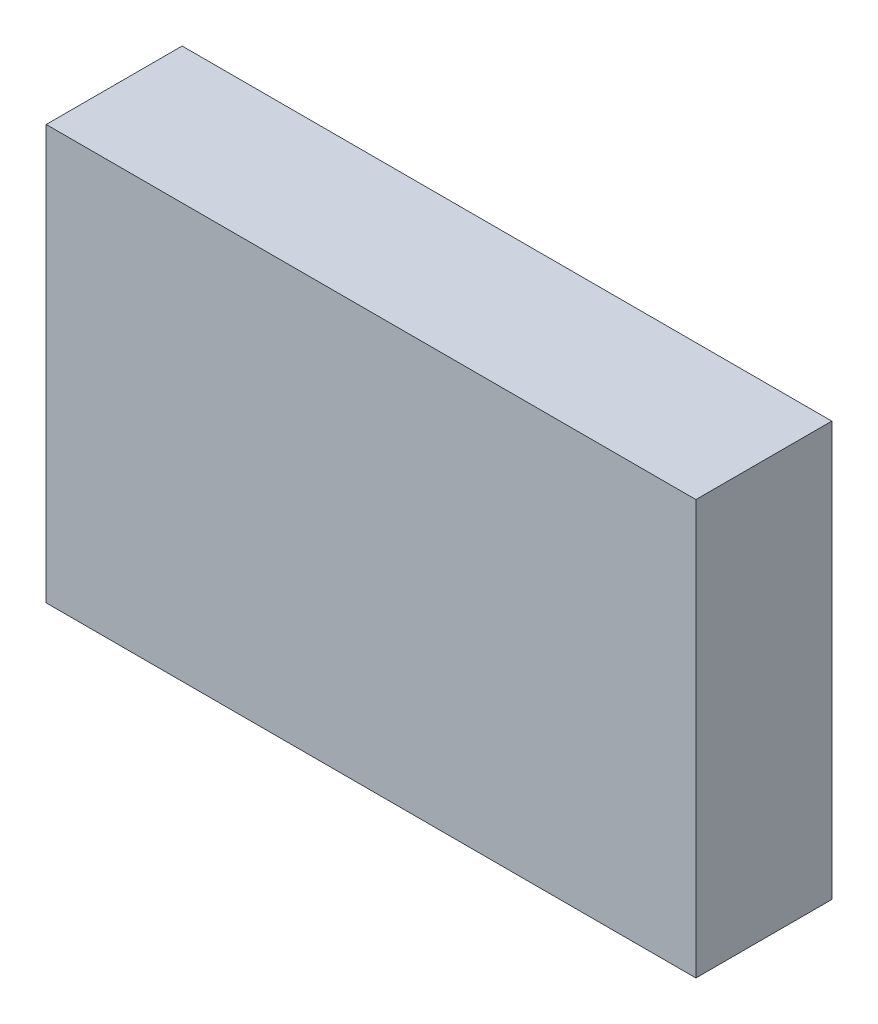
from build123d import *

# Parameters (mm, degrees)
ESBO_O1_W                = 1.96
ESBO_O1_H                = 1.25
RESSALTO_EXTRUS_O1_DEPTH = 0.41


with BuildPart() as part:
    # Esboço1 → Ressalto-extrusão1 (new body)
    with BuildSketch(Plane.XY):
        with Locations((-20.786825762, -15.868419521)):
            Rectangle(ESBO_O1_W, ESBO_O1_H)
    extrude(amount=RESSALTO_EXTRUS_O1_DEPTH)


solid = part.part
